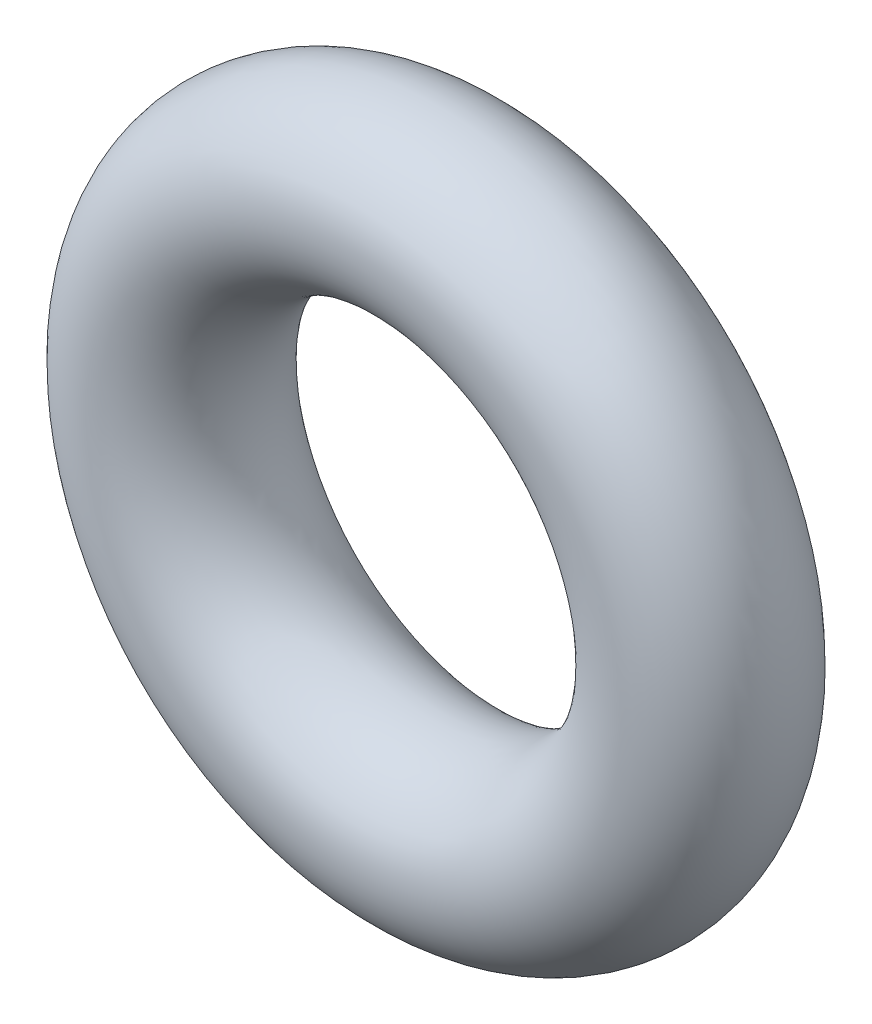
from build123d import *

# Parameters (mm, degrees)
O_RING_SKETCH_R = 0.5


with BuildPart() as part:
    # O-Ring Sketch → O-Ring Revolve (revolve)
    with BuildSketch(Plane(origin=(0, 0, 0), x_dir=(1, 0, 0), z_dir=(0, 1, 0))):
        with Locations((1.5, 0)):
            Circle(O_RING_SKETCH_R)
    revolve(axis=Axis((0, 0, 0), (0, 0, -1)))


solid = part.part
